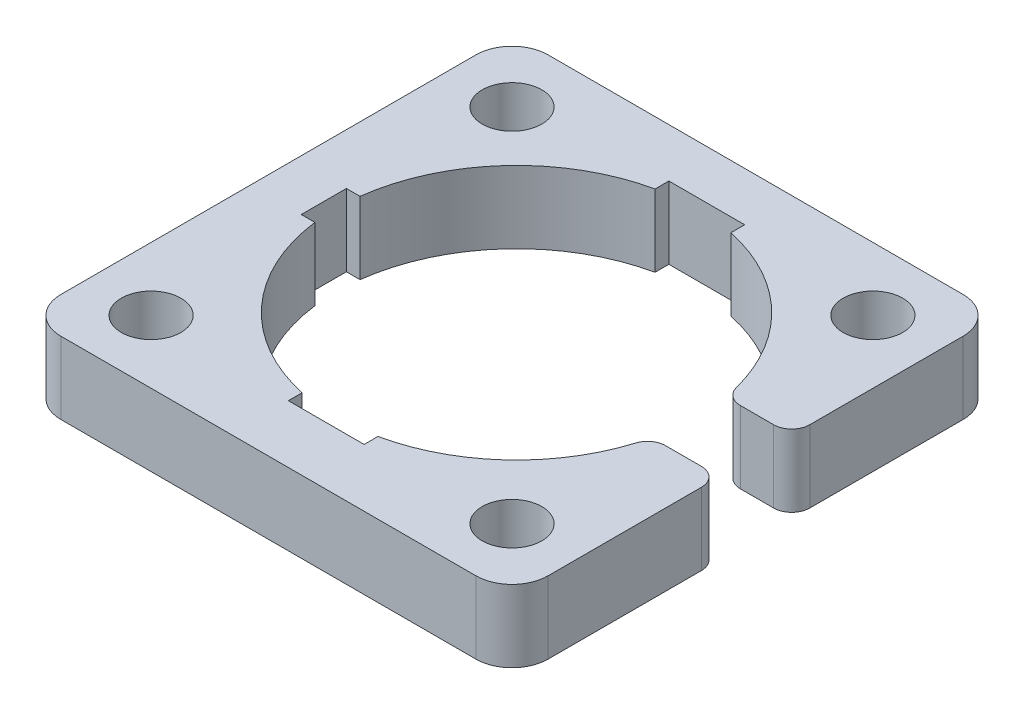
from build123d import *

# Parameters (mm, degrees)
SKETCH1_W           = 27
SKETCH1_H           = 27
SKETCH1_R           = 1.65
BOSS_EXTRUDE1_DEPTH = 4
CUT_EXTRUDE1_DEPTH  = 20.506409203
FILLET2_R           = 2
SKETCH5_W           = 14.325764552
SKETCH5_H           = 4
CUT_EXTRUDE2_DEPTH  = 20.506409203
FILLET3_R           = 1


with BuildPart() as part:
    # Sketch1 → Boss-Extrude1 (new body)
    with BuildSketch(Plane(origin=(0, 0, 0), x_dir=(1, 0, 0), z_dir=(0, 1, 0))):
        Rectangle(SKETCH1_W, SKETCH1_H)
        with Locations(Location((10, 10, 0), (0, 0, 270))):
            Circle(SKETCH1_R, mode=Mode.SUBTRACT)
        with Locations(Location((10, -10, 0), (0, 0, 270))):
            Circle(SKETCH1_R, mode=Mode.SUBTRACT)
        with Locations(Location((-10, -10, 0), (0, 0, 270))):
            Circle(SKETCH1_R, mode=Mode.SUBTRACT)
        with Locations(Location((-10, 10, 0), (0, 0, 270))):
            Circle(SKETCH1_R, mode=Mode.SUBTRACT)
    extrude(amount=BOSS_EXTRUDE1_DEPTH)

    # Sketch2 → Cut-Extrude1 (cut, through all)
    with BuildSketch(Plane(origin=(0, 4, 0), x_dir=(1, 0, 0), z_dir=(0, 1, 0))):
        with BuildLine():
            Line((-9.921567416, 1.5), (-10.677078252, 1.5))
            Line((-10.677078252, 1.5), (-10.677078252, -1))
            Line((-10.677078252, -1), (-9.921567416, -1))
            ThreePointArc((-9.921567416, -1), (-7.36932915, -6.509658858), (-2.1, -9.527013859))
            Line((-2.1, -9.527013859), (-2.1, -10.292888598))
            Line((-2.1, -10.292888598), (2.1, -10.292888598))
            Line((2.1, -10.292888598), (2.1, -9.527013859))
            ThreePointArc((2.1, -9.527013859), (7.36932915, -6.509658858), (9.921567416, -1))
            Line((9.921567416, -1), (10.677078252, -1))
            Line((10.677078252, -1), (10.677078252, 1.5))
            Line((10.677078252, 1.5), (9.921567416, 1.5))
            ThreePointArc((9.921567416, 1.5), (7.36932915, 7.009658858), (2.1, 10.027013859))
            Line((2.1, 10.027013859), (2.1, 10.792888598))
            Line((2.1, 10.792888598), (-2.1, 10.792888598))
            Line((-2.1, 10.792888598), (-2.1, 10.027013859))
            ThreePointArc((-2.1, 10.027013859), (-7.36932915, 7.009658858), (-9.921567416, 1.5))
        make_face()
    extrude(amount=-CUT_EXTRUDE1_DEPTH, mode=Mode.SUBTRACT)

    # Fillet2
    fillet2_edges = [part.edges().sort_by_distance(p)[0] for p in [
        (13.5, 2, 13.5),
        (-13.5, 2, 13.5),
        (-13.5, 2, -13.5),
        (13.5, 2, -13.5),
    ]]
    fillet(fillet2_edges, radius=FILLET2_R)

    # Sketch5 → Cut-Extrude2 (cut, through all)
    with BuildSketch(Plane(origin=(0, 4, 0), x_dir=(1, 0, 0), z_dir=(0, 1, 0))):
        with Locations((10.779204511, 0)):
            Rectangle(SKETCH5_W, SKETCH5_H)
    extrude(amount=-CUT_EXTRUDE2_DEPTH, mode=Mode.SUBTRACT)

    # Fillet3
    fillet3_edges = [part.edges().sort_by_distance(p)[0] for p in [
        (9.743587635, 2, 2),
        (9.845684334, 2, -2),
        (13.5, 2, -2),
        (13.5, 2, 2),
    ]]
    fillet(fillet3_edges, radius=FILLET3_R)


solid = part.part
